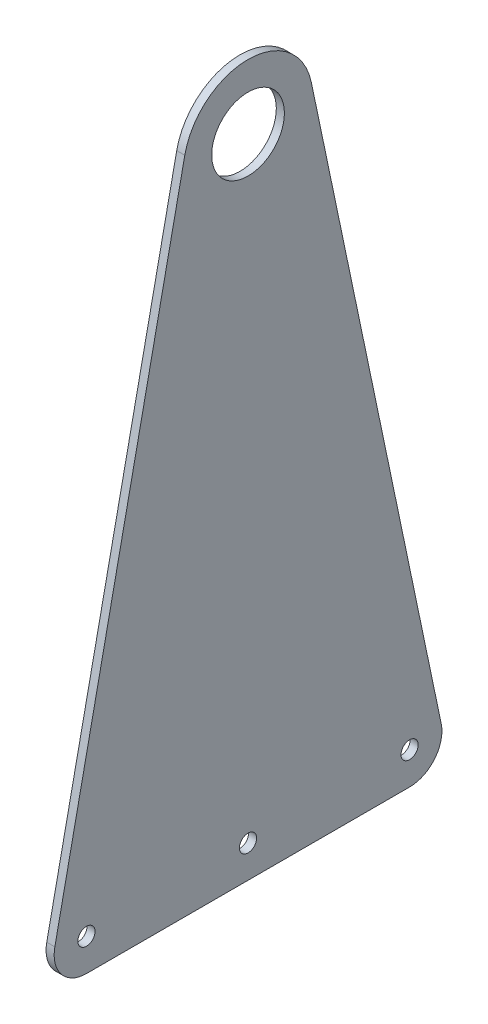
from build123d import *

# Parameters (mm, degrees)
SKETCH1_R           = 14.2875
SKETCH1_R_2         = 3.3782
BOSS_EXTRUDE1_DEPTH = 3.175


with BuildPart() as part:
    # Sketch1 → Boss-Extrude1 (new body)
    with BuildSketch(Plane(origin=(0, 0, 0), x_dir=(0, 0, -1), z_dir=(1, 0, 0))):
        with BuildLine():
            Line((-75.93043495, -238.69725396), (-24.860869901, 5.205492079))
            ThreePointArc((-24.860869901, 5.205492079), (0, 25.4), (24.860869901, 5.205492079))
            Line((24.860869901, 5.205492079), (75.93043495, -238.69725396))
            ThreePointArc((75.93043495, -238.69725396), (73.357608095, -249.307344294), (63.5, -254))
            Line((63.5, -254), (-63.5, -254))
            ThreePointArc((-63.5, -254), (-73.357608095, -249.307344294), (-75.93043495, -238.69725396))
        make_face()
        Circle(SKETCH1_R, mode=Mode.SUBTRACT)
        with Locations((-63.5, -241.3)):
            Circle(SKETCH1_R_2, mode=Mode.SUBTRACT)
        with Locations((0, -241.3)):
            Circle(SKETCH1_R_2, mode=Mode.SUBTRACT)
        with Locations((63.5, -241.3)):
            Circle(SKETCH1_R_2, mode=Mode.SUBTRACT)
    extrude(amount=BOSS_EXTRUDE1_DEPTH)


solid = part.part
